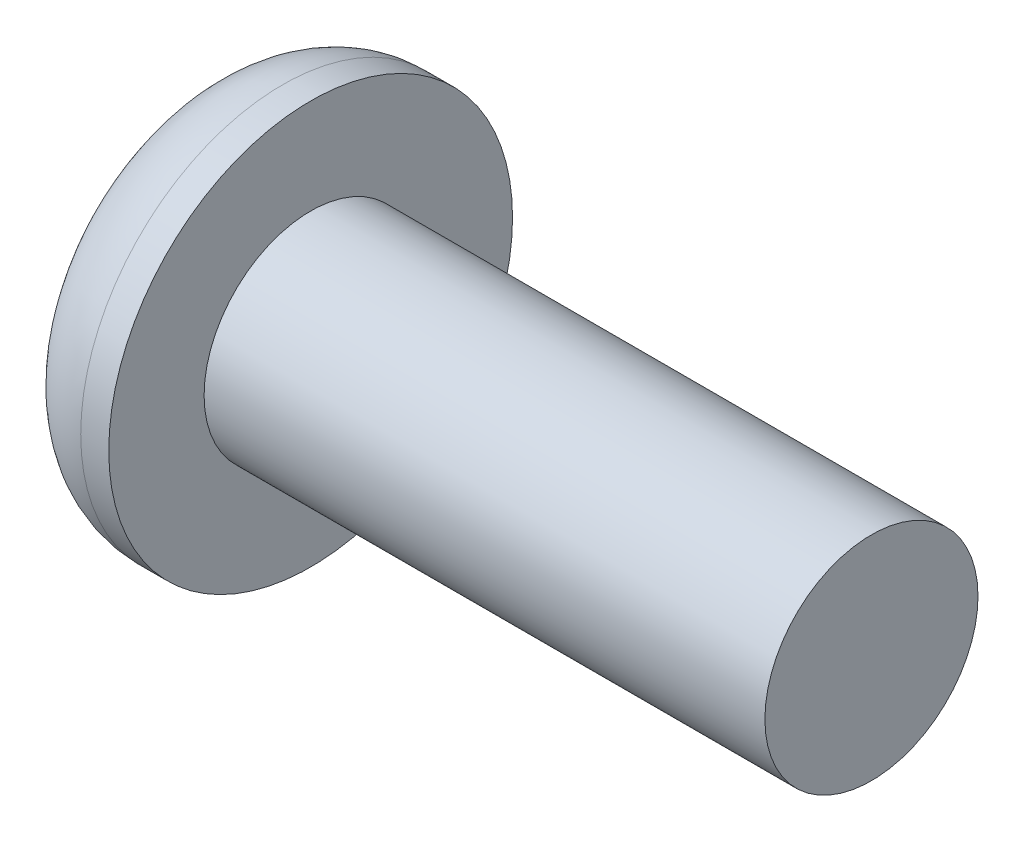
from build123d import *

# Parameters (mm, degrees)
SKETCH1_R           = 4.572
BOSS_EXTRUDE1_DEPTH = 2.54
SKETCH2_R           = 2.413
BOSS_EXTRUDE2_DEPTH = 12.7
FILLET1_R           = 1.905
CUT_EXTRUDE1_DEPTH  = 1.905


with BuildPart() as part:
    # Sketch1 → Boss-Extrude1 (new body)
    with BuildSketch(Plane(origin=(0, 0, 0), x_dir=(0, 0, -1), z_dir=(1, 0, 0))):
        Circle(SKETCH1_R)
    extrude(amount=BOSS_EXTRUDE1_DEPTH)

    # Sketch2 → Boss-Extrude2 (add)
    with BuildSketch(Plane(origin=(2.54, 0, 0), x_dir=(0, 0, -1), z_dir=(1, 0, 0))):
        Circle(SKETCH2_R)
    extrude(amount=BOSS_EXTRUDE2_DEPTH)

    # Fillet1
    fillet1_edges = [part.edges().sort_by_distance(p)[0] for p in [
        (0, 0, 4.572),
    ]]
    fillet(fillet1_edges, radius=FILLET1_R)

    # Sketch3 → Cut-Extrude1 (cut)
    with BuildSketch(Plane.ZY):
        Polygon((1.573613406, -0.940185716), (1.601031418, 0.892696328), (0.027418011, 1.832882044), (-1.573613406, 0.940185716), (-1.601031418, -0.892696328), (-0.027418011, -1.832882044), align=None)
    extrude(amount=-CUT_EXTRUDE1_DEPTH, mode=Mode.SUBTRACT)


solid = part.part
